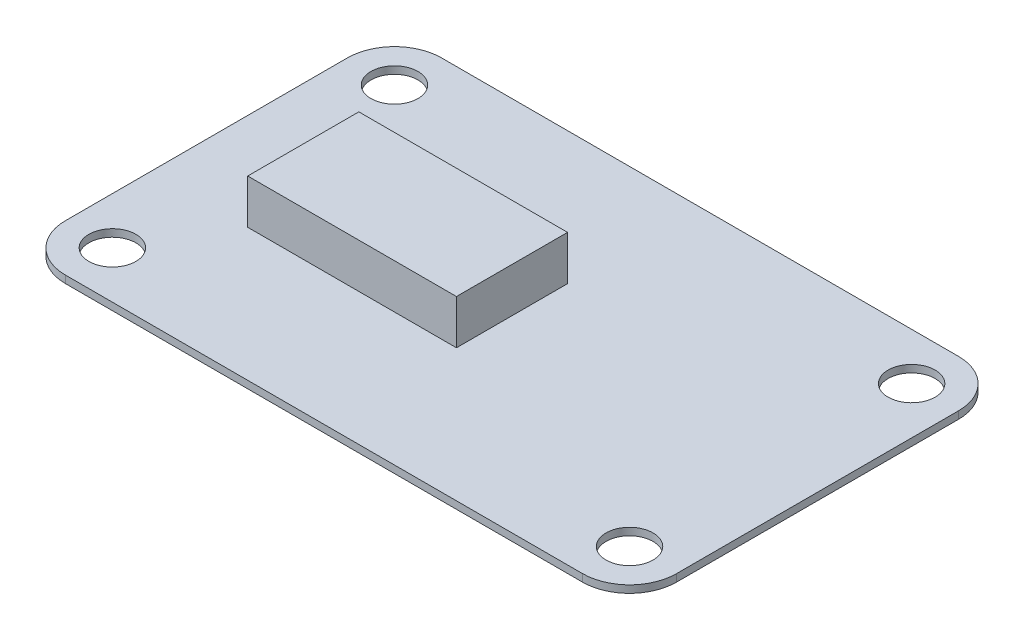
from build123d import *

# Parameters (mm, degrees)
SKETCH1_R           = 1.27
BOSS_EXTRUDE1_DEPTH = 0.4
SKETCH2_W           = 11.275942915
SKETCH2_H           = 6.002616378
BOSS_EXTRUDE2_DEPTH = 2.4


with BuildPart() as part:
    # Sketch1 → Boss-Extrude1 (new body)
    with BuildSketch(Plane(origin=(0, 0, 0), x_dir=(1, 0, 0), z_dir=(0, 1, 0))):
        with BuildLine():
            Line((13.97, -10.16), (-13.97, -10.16))
            ThreePointArc((-13.97, -10.16), (-15.766051224, -9.416051224), (-16.51, -7.62))
            Line((-16.51, -7.62), (-16.51, 7.62))
            ThreePointArc((-16.51, 7.62), (-15.766051224, 9.416051224), (-13.97, 10.16))
            Line((-13.97, 10.16), (13.97, 10.16))
            ThreePointArc((13.97, 10.16), (15.766051224, 9.416051224), (16.51, 7.62))
            Line((16.51, 7.62), (16.51, -7.62))
            ThreePointArc((16.51, -7.62), (15.766051224, -9.416051224), (13.97, -10.16))
        make_face()
        with Locations(Location((-13.97, 7.62, 0), (0, 0, 270))):
            Circle(SKETCH1_R, mode=Mode.SUBTRACT)
        with Locations(Location((13.97, 7.62, 0), (0, 0, 270))):
            Circle(SKETCH1_R, mode=Mode.SUBTRACT)
        with Locations(Location((13.97, -7.62, 0), (0, 0, 270))):
            Circle(SKETCH1_R, mode=Mode.SUBTRACT)
        with Locations(Location((-13.97, -7.62, 0), (0, 0, 270))):
            Circle(SKETCH1_R, mode=Mode.SUBTRACT)
    extrude(amount=BOSS_EXTRUDE1_DEPTH)

    # Sketch2 → Boss-Extrude2 (add)
    with BuildSketch(Plane(origin=(0, 0.4, 0), x_dir=(1, 0, 0), z_dir=(0, 1, 0))):
        with Locations((-5.637971457, 0)):
            Rectangle(SKETCH2_W, SKETCH2_H)
    extrude(amount=BOSS_EXTRUDE2_DEPTH)


solid = part.part
